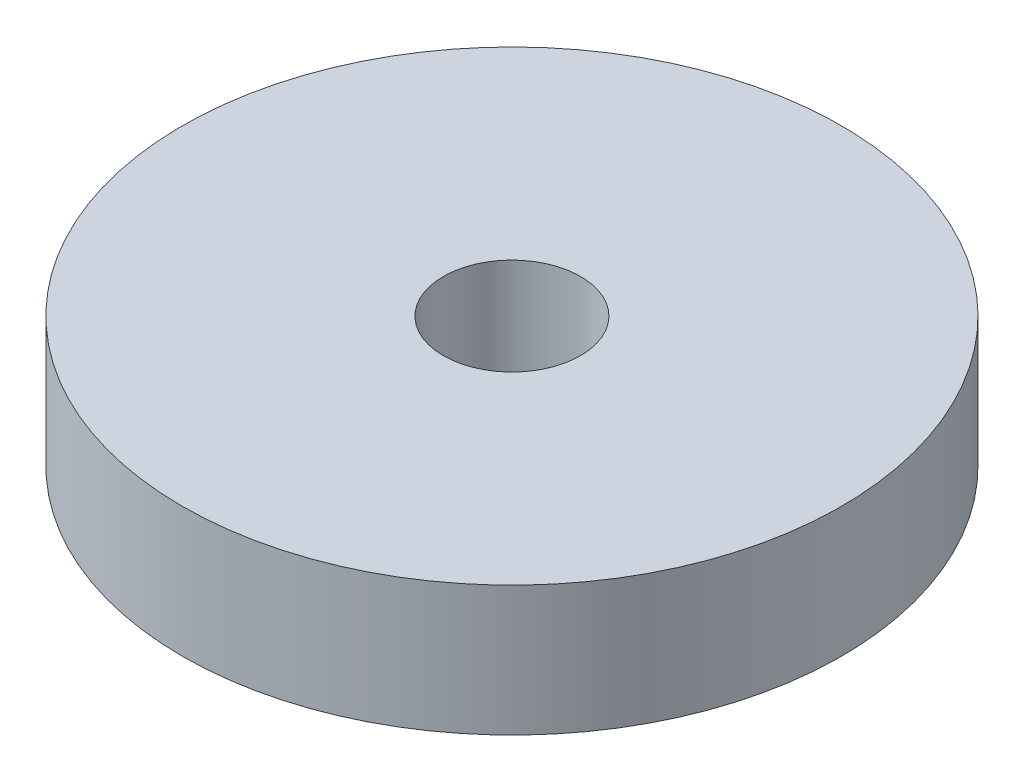
from build123d import *

# Parameters (mm, degrees)
SKETCH1_R           = 7.613586195
SKETCH1_R_2         = 1.585
BOSS_EXTRUDE1_DEPTH = 3


with BuildPart() as part:
    # Sketch1 → Boss-Extrude1 (new body)
    with BuildSketch(Plane(origin=(0, 0, 0), x_dir=(1, 0, 0), z_dir=(0, 1, 0))):
        with Locations(Location((0, 0, 0), (0, 0, 270))):
            Circle(SKETCH1_R)
        with Locations(Location((0, 0, 0), (0, 0, 270))):
            Circle(SKETCH1_R_2, mode=Mode.SUBTRACT)
    extrude(amount=BOSS_EXTRUDE1_DEPTH)


solid = part.part
